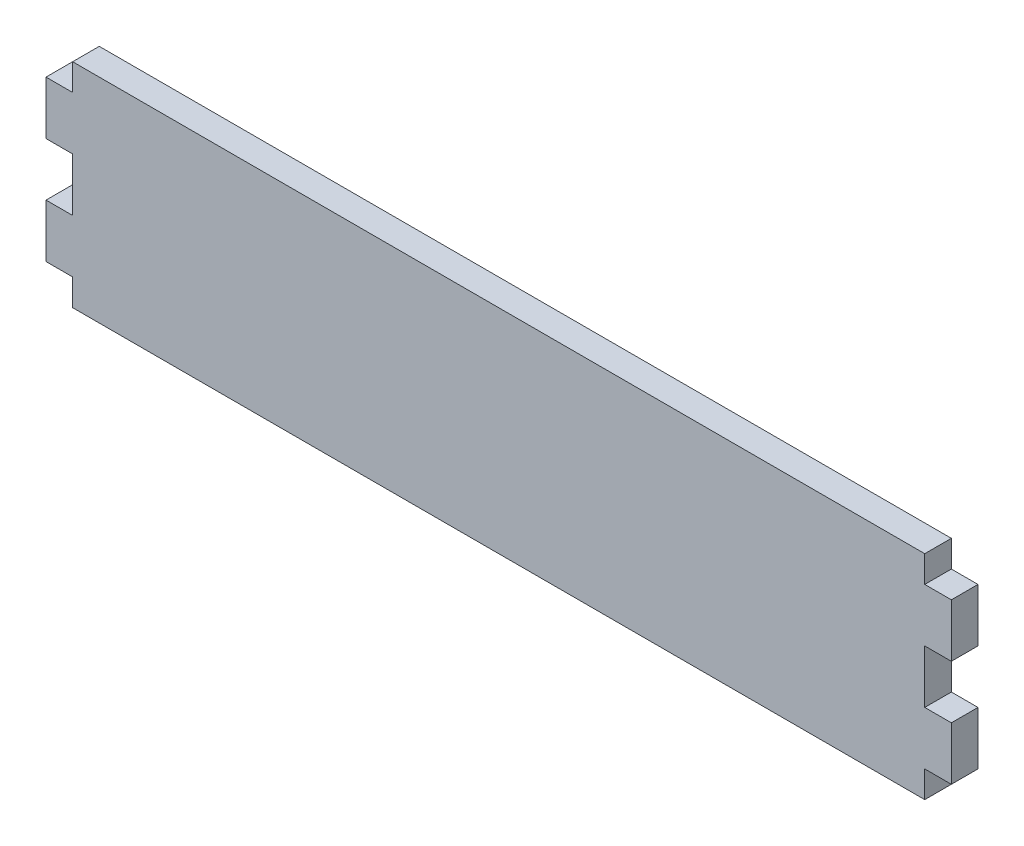
from build123d import *

# Parameters (mm, degrees)
BOSS_EXTRUDE1_DEPTH = 2.5


with BuildPart() as part:
    # Sketch1 → Boss-Extrude1 (new body)
    with BuildSketch(Plane.XY):
        Polygon((-40, 0), (40, 0), (40, 2.5), (42.5, 2.5), (42.5, 7.5), (40, 7.5), (40, 12.5), (42.5, 12.5), (42.5, 17.5), (40, 17.5), (40, 20), (-40, 20), (-40, 17.5), (-42.5, 17.5), (-42.5, 12.5), (-40, 12.5), (-40, 7.5), (-42.5, 7.5), (-42.5, 2.5), (-40, 2.5), align=None)
    extrude(amount=BOSS_EXTRUDE1_DEPTH)


solid = part.part
